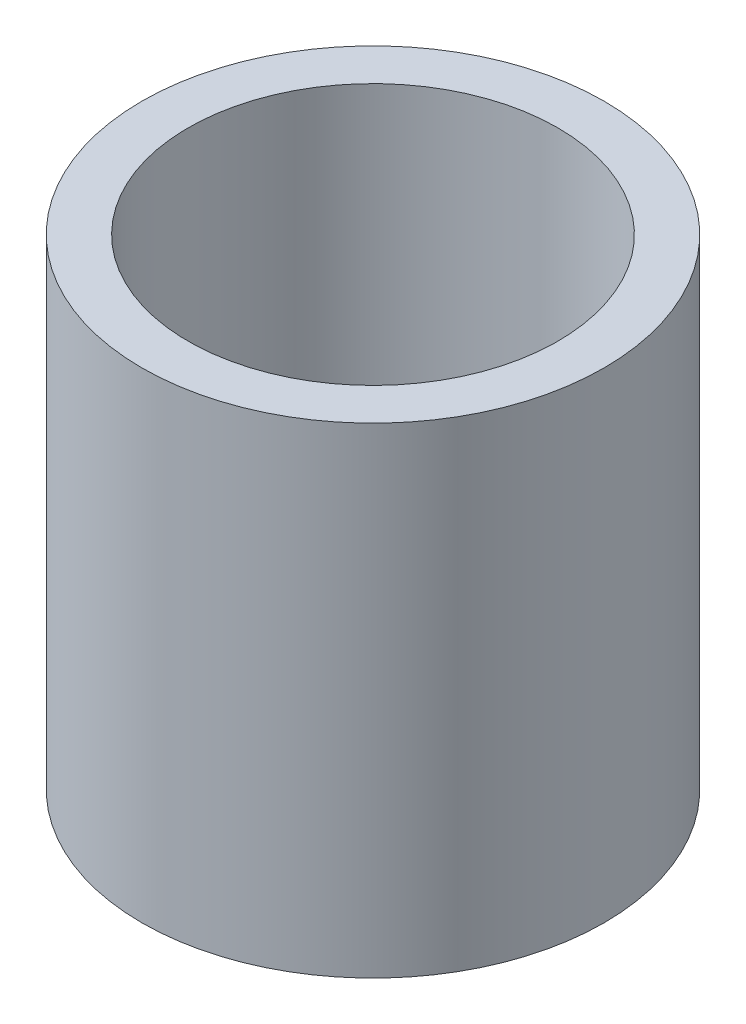
from build123d import *

# Parameters (mm, degrees)
SKETCH1_R           = 3.175
SKETCH1_R_2         = 2.54
BOSS_EXTRUDE1_DEPTH = 6.604


with BuildPart() as part:
    # Sketch1 → Boss-Extrude1 (new body)
    with BuildSketch(Plane(origin=(0, 0, 0), x_dir=(1, 0, 0), z_dir=(0, 1, 0))):
        Circle(SKETCH1_R)
        Circle(SKETCH1_R_2, mode=Mode.SUBTRACT)
    extrude(amount=BOSS_EXTRUDE1_DEPTH)


solid = part.part
